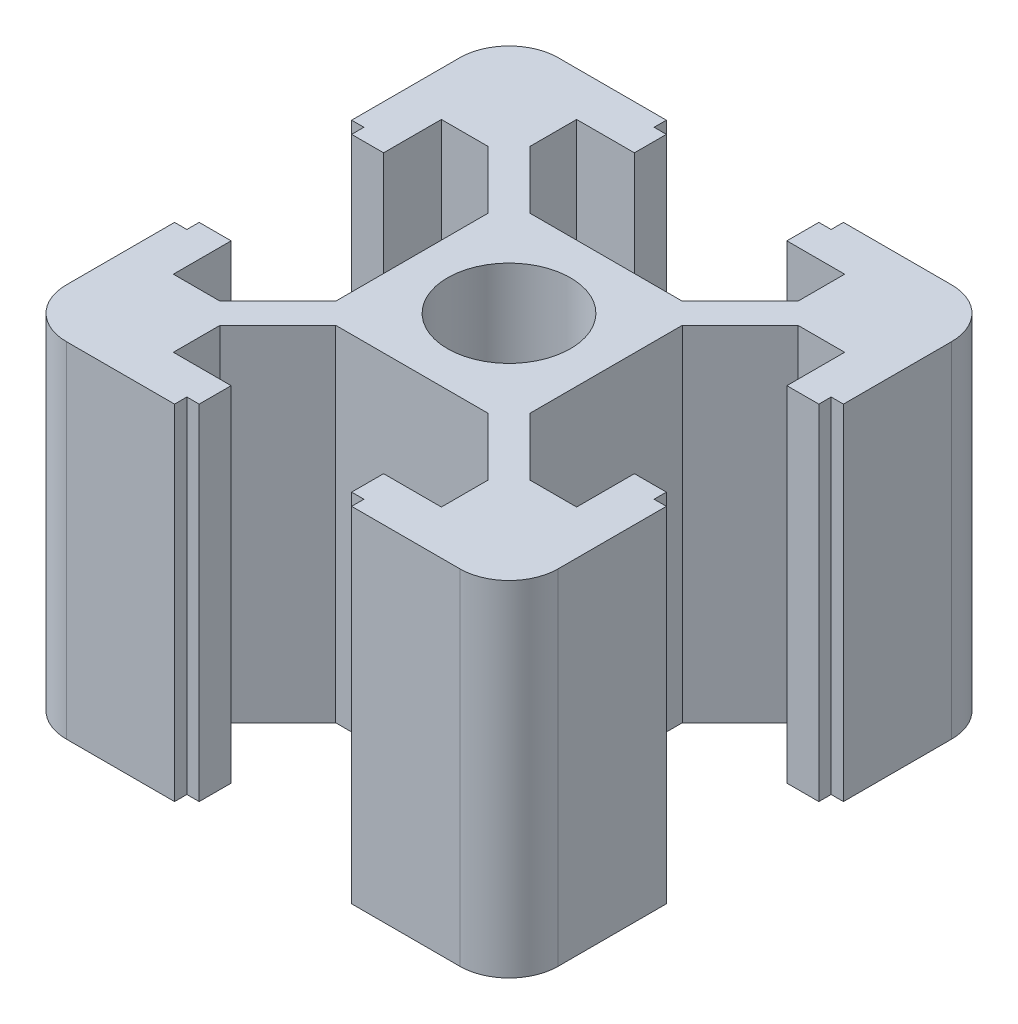
from build123d import *

# Parameters (mm, degrees)
SKETCH_1_R      = 2.5
EXTRUDE_1_DEPTH = 14


with BuildPart() as part:
    # 草图1 → 凸台-拉伸1 (new body)
    with BuildSketch(Plane(origin=(0, 0, 0), x_dir=(1, 0, 0), z_dir=(0, 1, 0))):
        with BuildLine():
            Line((-3.948528137, -3.1), (-6.298528137, -5.45))
            Line((-6.298528137, -5.45), (-8.2, -5.45))
            Line((-8.2, -5.45), (-8.2, -3.1))
            Line((-8.2, -3.1), (-9.5, -3.1))
            Line((-9.5, -3.1), (-9.5, -3.6))
            Line((-9.5, -3.6), (-10, -3.6))
            Line((-10, -3.6), (-10, -8))
            ThreePointArc((-10, -8), (-9.414213562, -9.414213562), (-8, -10))
            Line((-8, -10), (-3.6, -10))
            Line((-3.6, -10), (-3.6, -9.5))
            Line((-3.6, -9.5), (-3.1, -9.5))
            Line((-3.1, -9.5), (-3.1, -8.2))
            Line((-3.1, -8.2), (-5.45, -8.2))
            Line((-5.45, -8.2), (-5.45, -6.298528137))
            Line((-5.45, -6.298528137), (-3.1, -3.948528137))
            Line((-3.1, -3.948528137), (0, -3.948528137))
            Line((0, -3.948528137), (3.1, -3.948528137))
            Line((3.1, -3.948528137), (5.45, -6.298528137))
            Line((5.45, -6.298528137), (5.45, -8.2))
            Line((5.45, -8.2), (3.1, -8.2))
            Line((3.1, -8.2), (3.1, -9.5))
            Line((3.1, -9.5), (3.6, -9.5))
            Line((3.6, -9.5), (3.6, -10))
            Line((3.6, -10), (8, -10))
            ThreePointArc((8, -10), (9.414213562, -9.414213562), (10, -8))
            Line((10, -8), (10, -3.6))
            Line((10, -3.6), (9.5, -3.6))
            Line((9.5, -3.6), (9.5, -3.1))
            Line((9.5, -3.1), (8.2, -3.1))
            Line((8.2, -3.1), (8.2, -5.45))
            Line((8.2, -5.45), (6.298528137, -5.45))
            Line((6.298528137, -5.45), (3.948528137, -3.1))
            Line((3.948528137, -3.1), (3.948528137, 0))
            Line((3.948528137, 0), (3.948528137, 3.1))
            Line((3.948528137, 3.1), (6.298528137, 5.45))
            Line((6.298528137, 5.45), (8.2, 5.45))
            Line((8.2, 5.45), (8.2, 3.1))
            Line((8.2, 3.1), (9.5, 3.1))
            Line((9.5, 3.1), (9.5, 3.6))
            Line((9.5, 3.6), (10, 3.6))
            Line((10, 3.6), (10, 8))
            ThreePointArc((10, 8), (9.414213562, 9.414213562), (8, 10))
            Line((8, 10), (3.6, 10))
            Line((3.6, 10), (3.6, 9.5))
            Line((3.6, 9.5), (3.1, 9.5))
            Line((3.1, 9.5), (3.1, 8.2))
            Line((3.1, 8.2), (5.45, 8.2))
            Line((5.45, 8.2), (5.45, 6.298528137))
            Line((5.45, 6.298528137), (3.1, 3.948528137))
            Line((3.1, 3.948528137), (0, 3.948528137))
            Line((0, 3.948528137), (-3.1, 3.948528137))
            Line((-3.1, 3.948528137), (-5.45, 6.298528137))
            Line((-5.45, 6.298528137), (-5.45, 8.2))
            Line((-5.45, 8.2), (-3.1, 8.2))
            Line((-3.1, 8.2), (-3.1, 9.5))
            Line((-3.1, 9.5), (-3.6, 9.5))
            Line((-3.6, 9.5), (-3.6, 10))
            Line((-3.6, 10), (-8, 10))
            ThreePointArc((-8, 10), (-9.414213562, 9.414213562), (-10, 8))
            Line((-10, 8), (-10, 3.6))
            Line((-10, 3.6), (-9.5, 3.6))
            Line((-9.5, 3.6), (-9.5, 3.1))
            Line((-9.5, 3.1), (-8.2, 3.1))
            Line((-8.2, 3.1), (-8.2, 5.45))
            Line((-8.2, 5.45), (-6.298528137, 5.45))
            Line((-6.298528137, 5.45), (-3.948528137, 3.1))
            Line((-3.948528137, 3.1), (-3.948528137, 0))
            Line((-3.948528137, 0), (-3.948528137, -3.1))
        make_face()
        with Locations(Location((0, 0, 0), (0, 0, 270))):
            Circle(SKETCH_1_R, mode=Mode.SUBTRACT)
    extrude(amount=EXTRUDE_1_DEPTH)


solid = part.part
